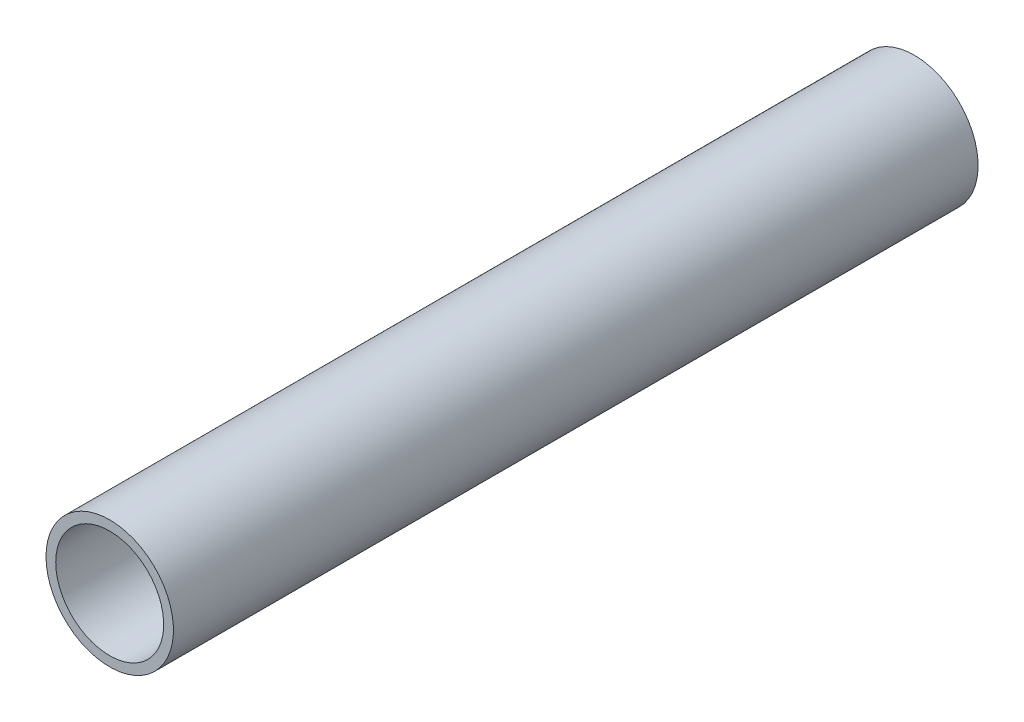
from build123d import *

# Parameters (mm, degrees)
SKETCH2_R              = 24.13
SKETCH2_R_2            = 20.447
BASE_DEPTH             = 304.8
SNAP_RING_GROOVE_START = -6.35
SKETCH3_R              = 21.9075
SKETCH3_R_2            = 20.447
SNAP_RING_GROOVE_DEPTH = 1.7272


with BuildPart() as part:
    # Sketch2 → base (new body)
    with BuildSketch(Plane(origin=(0, 0, 0), x_dir=(0, 1, 0), z_dir=(0, 0, 1))):
        with Locations(Location((0, 0, 0), (0, 0, 90))):
            Circle(SKETCH2_R)
        with Locations(Location((0, 0, 0), (0, 0, 90))):
            Circle(SKETCH2_R_2, mode=Mode.SUBTRACT)
    extrude(amount=BASE_DEPTH)

    # Sketch3 → snap_ring_groove (cut)
    with BuildSketch(Plane(origin=(0, 0, 0), x_dir=(1, 0, 0), z_dir=(0, 0, -1)).offset(SNAP_RING_GROOVE_START)):
        with Locations(Location((0, 0, 0), (0, 0, 180))):
            Circle(SKETCH3_R)
        with Locations(Location((0, 0, 0), (0, 0, 180))):
            Circle(SKETCH3_R_2, mode=Mode.SUBTRACT)
    extrude(amount=-SNAP_RING_GROOVE_DEPTH, mode=Mode.SUBTRACT)


solid = part.part
